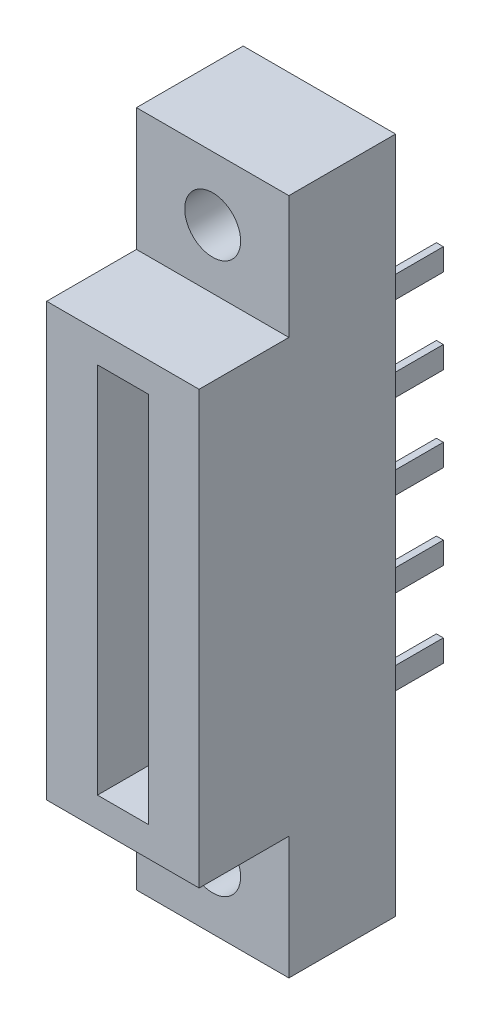
from build123d import *

# Parameters (mm, degrees)
SKETCH_1_W          = 9
SKETCH_1_H          = 40
EXTRUDE_1_DEPTH     = 6.3
SKETCH_2_W          = 9
SKETCH_2_H          = 25.5
EXTRUDE_2_DEPTH     = 5.3
SKETCH_3_R          = 1.65
CUT_EXTRUDE_1_DEPTH = 15.3
SKETCH_4_W          = 0.410265385
SKETCH_4_H          = 1.299173718
EXTRUDE_3_DEPTH     = 5
SKETCH_5_W          = 3
SKETCH_5_H          = 22
CUT_EXTRUDE_2_DEPTH = 8


with BuildPart() as part:
    # 草图1 → 拉伸1 (new body)
    with BuildSketch(Plane.XY):
        Rectangle(SKETCH_1_W, SKETCH_1_H)
    extrude(amount=EXTRUDE_1_DEPTH)

    # 草图2 → 拉伸2 (add)
    with BuildSketch(Plane.XY.offset(6.3)):
        Rectangle(SKETCH_2_W, SKETCH_2_H)
    extrude(amount=EXTRUDE_2_DEPTH)

    # 草图3 → 切除-拉伸1 (cut)
    with BuildSketch(Plane.XY.offset(6.3)):
        with Locations((0, 16.25)):
            Circle(SKETCH_3_R)
        with Locations((0, -16.25)):
            Circle(SKETCH_3_R)
    extrude(amount=-CUT_EXTRUDE_1_DEPTH, mode=Mode.SUBTRACT)

    # 草图4 → 拉伸3 (add)
    with BuildSketch(Plane(origin=(0, 0, 0), x_dir=(-1, 0, 0), z_dir=(0, 0, -1))):
        with Locations((2.428938656, 10)):
            Rectangle(SKETCH_4_W, SKETCH_4_H)
        with Locations((-2.113574837, 10)):
            Rectangle(SKETCH_4_W, SKETCH_4_H)
        with Locations((2.428938656, 5)):
            Rectangle(SKETCH_4_W, SKETCH_4_H)
        with Locations((-2.113574837, 5)):
            Rectangle(SKETCH_4_W, SKETCH_4_H)
        with Locations((2.428938656, 0)):
            Rectangle(SKETCH_4_W, SKETCH_4_H)
        with Locations((-2.113574837, 0)):
            Rectangle(SKETCH_4_W, SKETCH_4_H)
        with Locations((-2.113574837, -5)):
            Rectangle(SKETCH_4_W, SKETCH_4_H)
        with Locations((2.428938656, -5)):
            Rectangle(SKETCH_4_W, SKETCH_4_H)
        with Locations((-2.113574837, -10)):
            Rectangle(SKETCH_4_W, SKETCH_4_H)
        with Locations((2.428938656, -10)):
            Rectangle(SKETCH_4_W, SKETCH_4_H)
    extrude(amount=EXTRUDE_3_DEPTH)

    # 草图5 → 切除-拉伸2 (cut)
    with BuildSketch(Plane.XY.offset(11.6)):
        Rectangle(SKETCH_5_W, SKETCH_5_H)
    extrude(amount=-CUT_EXTRUDE_2_DEPTH, mode=Mode.SUBTRACT)


solid = part.part
